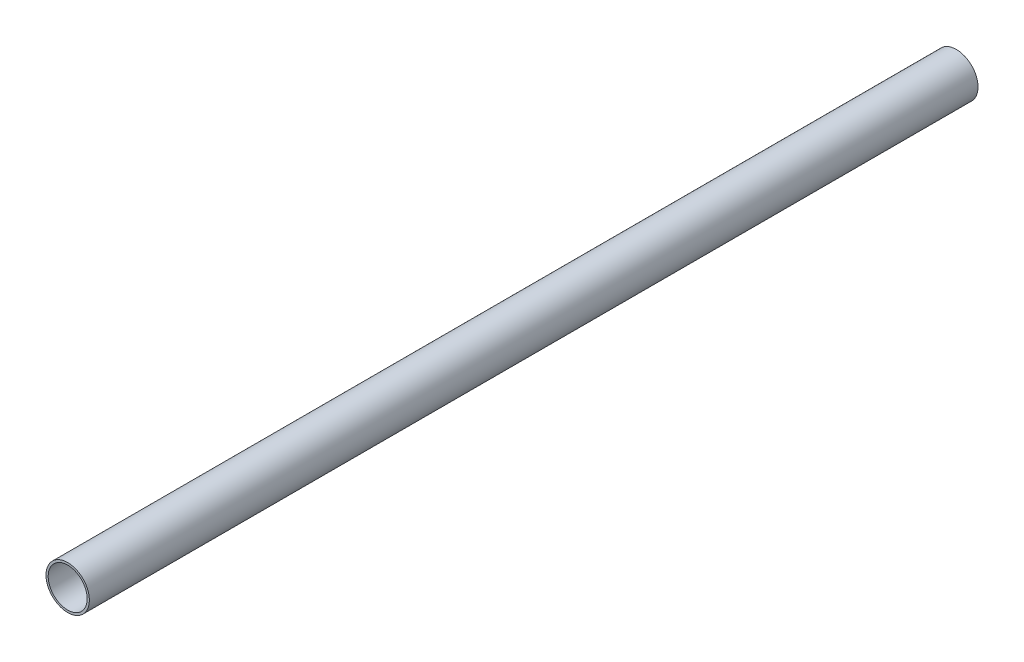
from build123d import *

# Parameters (mm, degrees)
SKETCH2_R           = 10
SKETCH2_R_2         = 9
BOSS_EXTRUDE1_DEPTH = 410


with BuildPart() as part:
    # Sketch2 → Boss-Extrude1 (new body)
    with BuildSketch(Plane.XY):
        with Locations(Location((0, 0, 0), (0, 0, 180))):
            Circle(SKETCH2_R)
        with Locations(Location((0, 0, 0), (0, 0, 180))):
            Circle(SKETCH2_R_2, mode=Mode.SUBTRACT)
    extrude(amount=BOSS_EXTRUDE1_DEPTH)


solid = part.part
